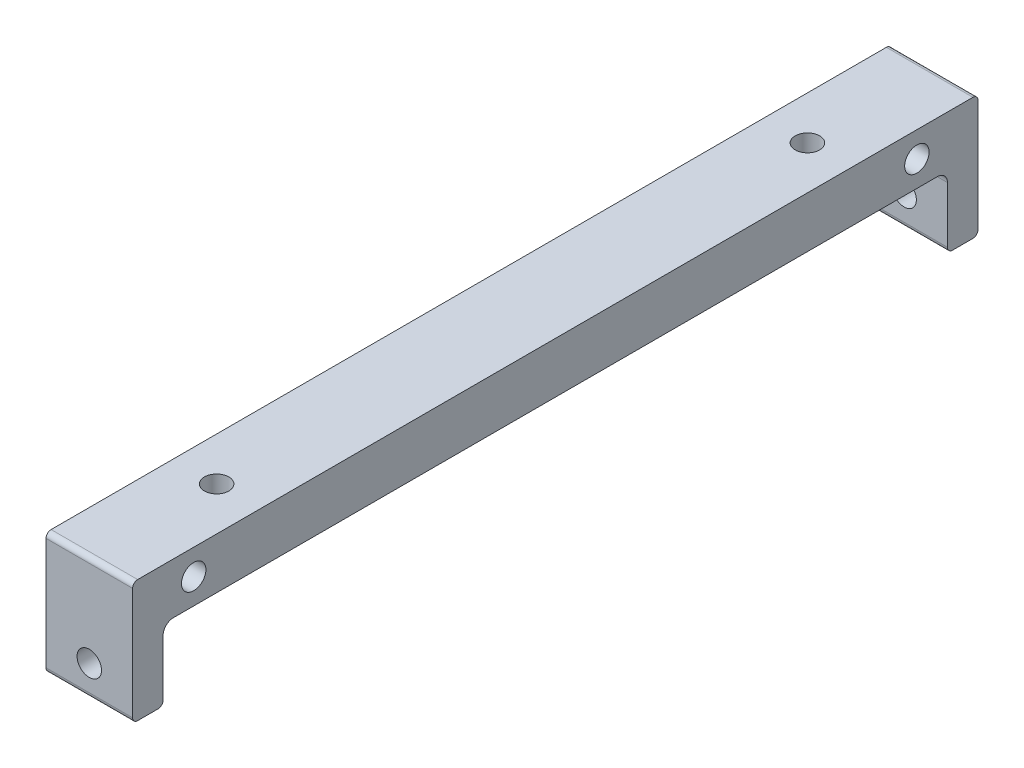
from build123d import *

# Parameters (mm, degrees)
SKETCH1_W           = 8.5
SKETCH1_H           = 12
BOSS_EXTRUDE1_DEPTH = 41.5
CUT_EXTRUDE1_DEPTH  = 43.784342931
FILLET1_R           = 0.5
M2_HOLE1_J_D        = 2.4
M2_HOLE1_J_DEPTH    = 5
M2_HOLE1_J_TIP      = 0.721032743
M2_HOLE2_K_D        = 2.4
M2_HOLE2_K_DEPTH    = 5
M2_HOLE2_K_TIP      = 0.721032743
M2_HOLE3_L_D        = 2.4
M2_HOLE3_L_DEPTH    = 10
M2_HOLE3_L_TIP      = 0.721032743
M2_HOLE4_M_D        = 2.4
M2_HOLE5_N_D        = 2.4
M2_HOLE5_N_DEPTH    = 4
M2_HOLE5_N_TIP      = 0.721032743
M2_HOLE6_P_D        = 2.4
M2_HOLE6_P_DEPTH    = 10
M2_HOLE6_P_TIP      = 0.721032743


with BuildPart() as part:
    # Sketch1 → Boss-Extrude1 (new, symmetric)
    with BuildSketch(Plane.XY):
        Rectangle(SKETCH1_W, SKETCH1_H)
    extrude(amount=BOSS_EXTRUDE1_DEPTH, both=True)

    # Sketch2 → Cut-Extrude1 (cut, through all)
    with BuildSketch(Plane(origin=(4.25, 0, 0), x_dir=(0, 0, -1), z_dir=(1, 0, 0))):
        with BuildLine():
            Line((-37.5, 1), (37.5, 1))
            ThreePointArc((37.5, 1), (38.207106781, 0.707106781), (38.5, 0))
            Line((38.5, 0), (38.5, -6))
            Line((38.5, -6), (-38.5, -6))
            Line((-38.5, -6), (-38.5, 0))
            ThreePointArc((-38.5, 0), (-38.207106781, 0.707106781), (-37.5, 1))
        make_face()
    extrude(amount=-CUT_EXTRUDE1_DEPTH, mode=Mode.SUBTRACT)

    # Fillet1
    fillet1_edges = [part.edges().sort_by_distance(p)[0] for p in [
        (0, -6, 41.5),
        (0, -6, -38.5),
        (0, -6, 38.5),
        (0, -6, -41.5),
        (0, 6, -41.5),
        (0, 6, 41.5),
    ]]
    fillet(fillet1_edges, radius=FILLET1_R)

    # M2 Hole1-J
    with Locations(Plane(origin=(4.25, 0, 0), x_dir=(0, 0, -1), z_dir=(1, 0, 0))):
        with Locations((-35.5, 3.5), (35.5, 3.5)):
            Hole(M2_HOLE1_J_D / 2, depth=M2_HOLE1_J_DEPTH)
            with Locations((0, 0, -(M2_HOLE1_J_DEPTH + M2_HOLE1_J_TIP / 2))):  # 118° drill point
                Cone(0, M2_HOLE1_J_D / 2, M2_HOLE1_J_TIP, mode=Mode.SUBTRACT)

    # M2 Hole2-K
    with Locations(Plane.ZY.offset(4.25)):
        with Locations((-21.5, 3.5), (21.5, 3.5)):
            Hole(M2_HOLE2_K_D / 2, depth=M2_HOLE2_K_DEPTH)
            with Locations((0, 0, -(M2_HOLE2_K_DEPTH + M2_HOLE2_K_TIP / 2))):  # 118° drill point
                Cone(0, M2_HOLE2_K_D / 2, M2_HOLE2_K_TIP, mode=Mode.SUBTRACT)

    # M2 Hole3-L
    with Locations(Plane.XY.offset(41.5)):
        with Locations((0, -3)):
            Hole(M2_HOLE3_L_D / 2, depth=M2_HOLE3_L_DEPTH)
            with Locations((0, 0, -(M2_HOLE3_L_DEPTH + M2_HOLE3_L_TIP / 2))):  # 118° drill point
                Cone(0, M2_HOLE3_L_D / 2, M2_HOLE3_L_TIP, mode=Mode.SUBTRACT)

    # M2 Hole4-M (through all)
    with Locations(Plane(origin=(0, 6, 0), x_dir=(1, 0, 0), z_dir=(0, 1, 0))):
        with Locations((0, 29), (0, -29)):
            Hole(M2_HOLE4_M_D / 2)

    # M2 Hole5-N
    with Locations(Plane.ZY.offset(4.25)):
        with Locations((0, 3.5)):
            Hole(M2_HOLE5_N_D / 2, depth=M2_HOLE5_N_DEPTH)
            with Locations((0, 0, -(M2_HOLE5_N_DEPTH + M2_HOLE5_N_TIP / 2))):  # 118° drill point
                Cone(0, M2_HOLE5_N_D / 2, M2_HOLE5_N_TIP, mode=Mode.SUBTRACT)

    # M2 Hole6-P
    with Locations(Plane(origin=(0, 0, -41.5), x_dir=(-1, 0, 0), z_dir=(0, 0, -1))):
        with Locations((0, -3)):
            Hole(M2_HOLE6_P_D / 2, depth=M2_HOLE6_P_DEPTH)
            with Locations((0, 0, -(M2_HOLE6_P_DEPTH + M2_HOLE6_P_TIP / 2))):  # 118° drill point
                Cone(0, M2_HOLE6_P_D / 2, M2_HOLE6_P_TIP, mode=Mode.SUBTRACT)


solid = part.part
